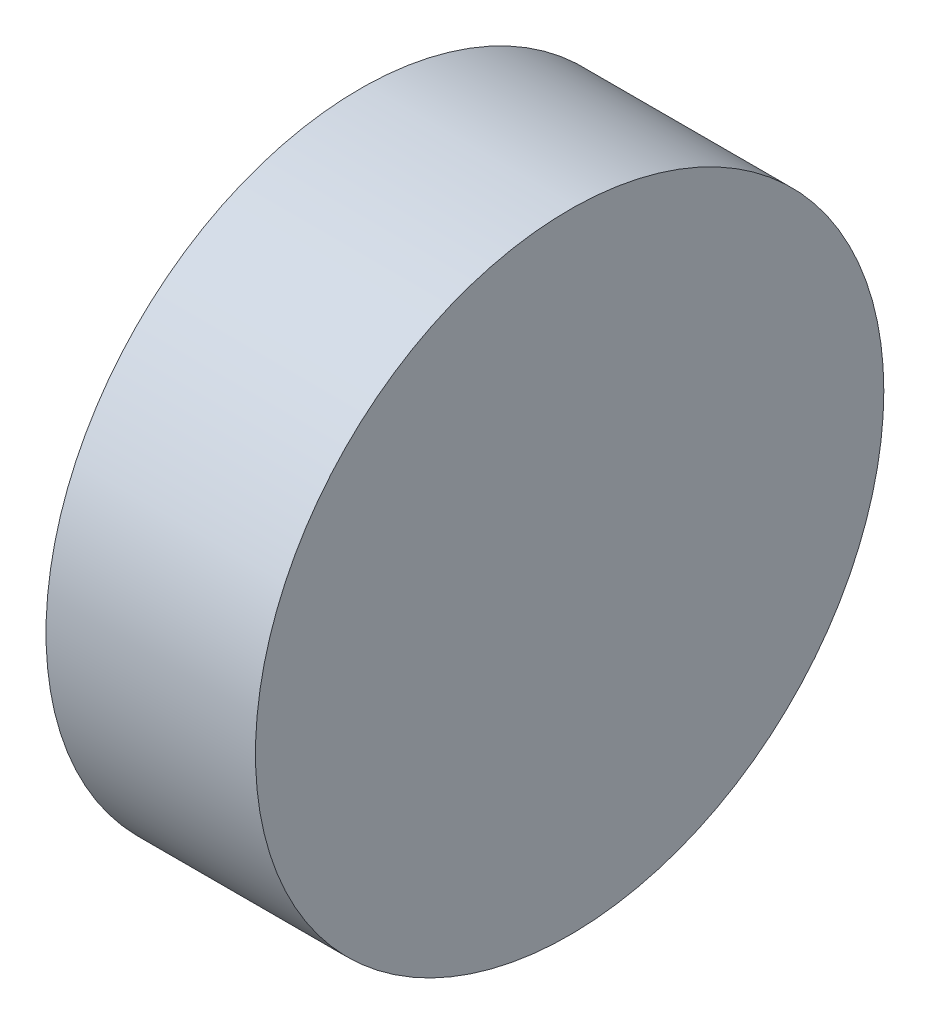
from build123d import *

# Parameters (mm, degrees)
BOSS_EXTRUDE1_DEPTH      = 1
BOSS_EXTRUDE1_DEPTH_BACK = 1
SKETCH1_R                = 3


with BuildPart() as part:
    # Sketch1 → Boss-Extrude1 (new, two sides: drawn at the far end of the back side and taken through both)
    with BuildSketch(Plane(origin=(0, 0, 0), x_dir=(0, 0, -1), z_dir=(1, 0, 0)).offset(-BOSS_EXTRUDE1_DEPTH_BACK)):
        Circle(SKETCH1_R)
    extrude(amount=BOSS_EXTRUDE1_DEPTH + BOSS_EXTRUDE1_DEPTH_BACK)


solid = part.part
